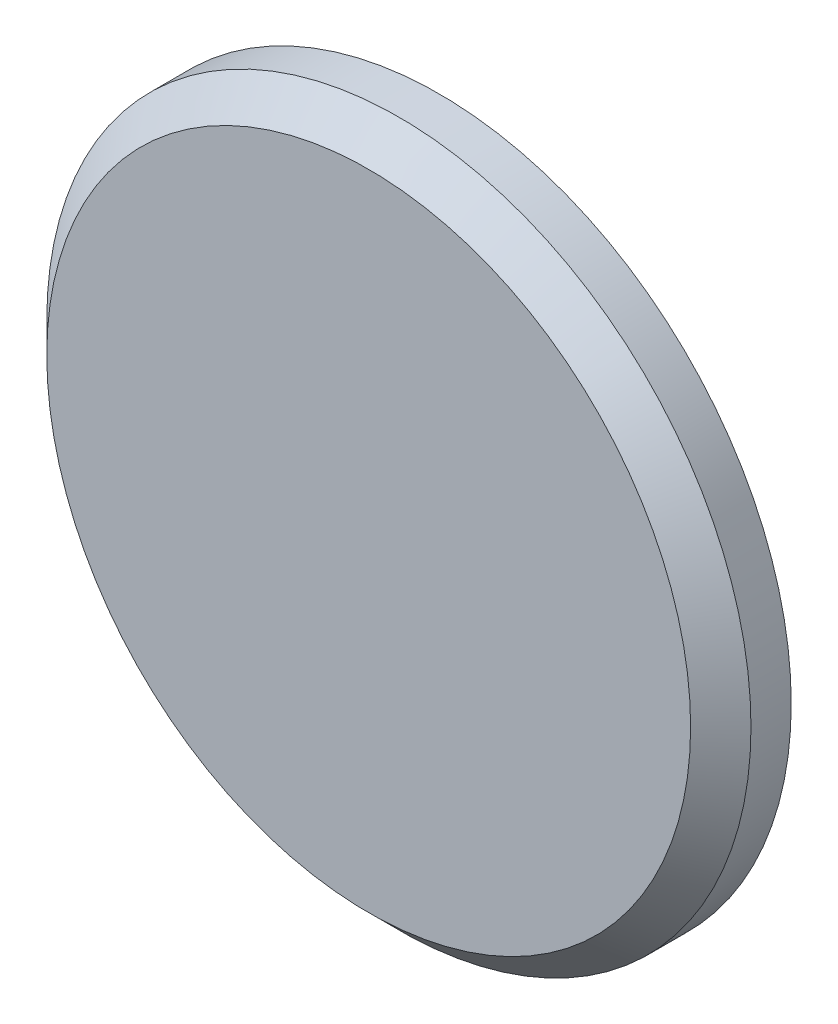
from build123d import *

# Parameters (mm, degrees)
SKETCH_1_R      = 35
EXTRUDE_1_DEPTH = 7
CHAMFER_1_SIZE  = 3


with BuildPart() as part:
    # 草图1 → 凸台-拉伸1 (new body)
    with BuildSketch(Plane.XY):
        Circle(SKETCH_1_R)
    extrude(amount=EXTRUDE_1_DEPTH)

    # 倒角1
    chamfer_1_edges = [part.edges().sort_by_distance(p)[0] for p in [
        (-35, 0, 7),
    ]]
    chamfer(chamfer_1_edges, length=CHAMFER_1_SIZE)


solid = part.part
